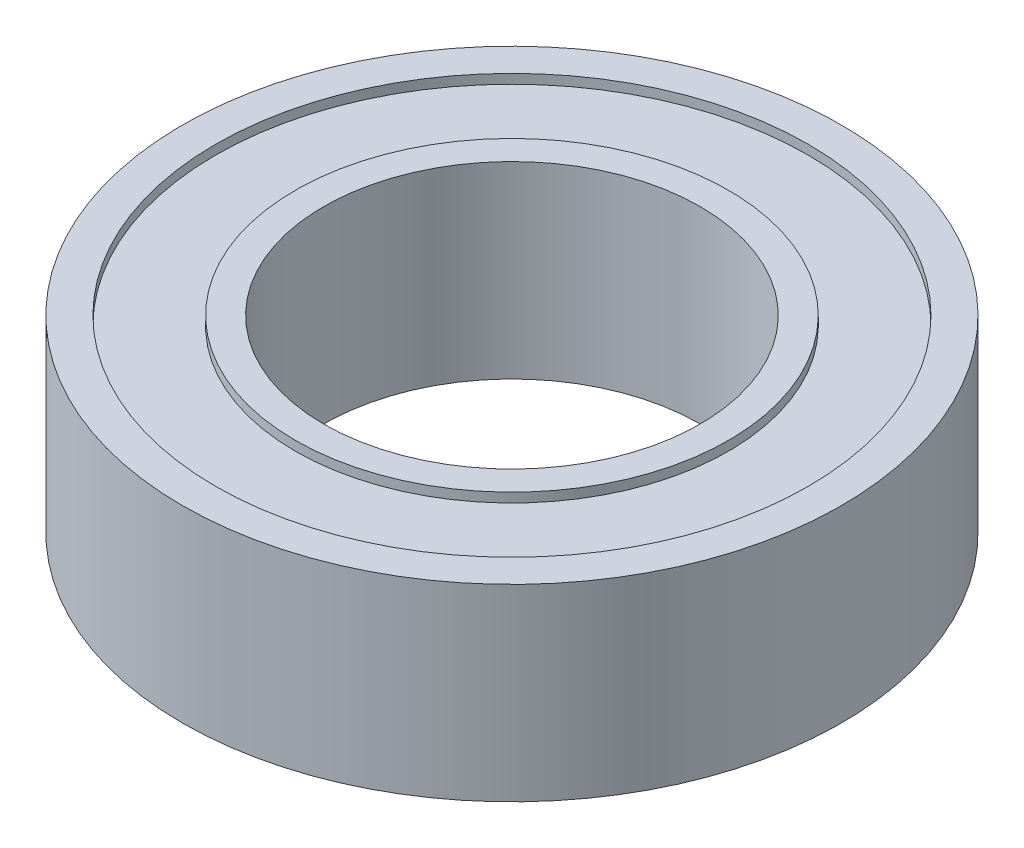
from build123d import *

# Parameters (mm, degrees)
SKETCH_1_R          = 3.5
SKETCH_1_R_2        = 2
EXTRUDE_1_DEPTH     = 1
SKETCH_2_R          = 3.146894392
SKETCH_2_R_2        = 2.300425052
CUT_EXTRUDE_1_DEPTH = 0.1


with BuildPart() as part:
    # 草图1 → 凸台-拉伸1 (new, symmetric)
    with BuildSketch(Plane(origin=(0, 0, 0), x_dir=(1, 0, 0), z_dir=(0, 1, 0))):
        with Locations(Location((0, 0, 0), (0, 0, 270))):
            Circle(SKETCH_1_R)
        with Locations(Location((0, 0, 0), (0, 0, 270))):
            Circle(SKETCH_1_R_2, mode=Mode.SUBTRACT)
    extrude(amount=EXTRUDE_1_DEPTH, both=True)

    # 草图2 → 切除-拉伸1 (cut)
    with BuildSketch(Plane(origin=(0, 1, 0), x_dir=(1, 0, 0), z_dir=(0, 1, 0))):
        with Locations(Location((0, 0, 0), (0, 0, 270))):
            Circle(SKETCH_2_R)
        with Locations(Location((0, 0, 0), (0, 0, 270))):
            Circle(SKETCH_2_R_2, mode=Mode.SUBTRACT)
    cut_extrude_1 = extrude(amount=-CUT_EXTRUDE_1_DEPTH, mode=Mode.SUBTRACT)

    # 镜向1: 切除-拉伸1 across plane
    add(cut_extrude_1.mirror(Plane.ZX), mode=Mode.SUBTRACT)


solid = part.part
